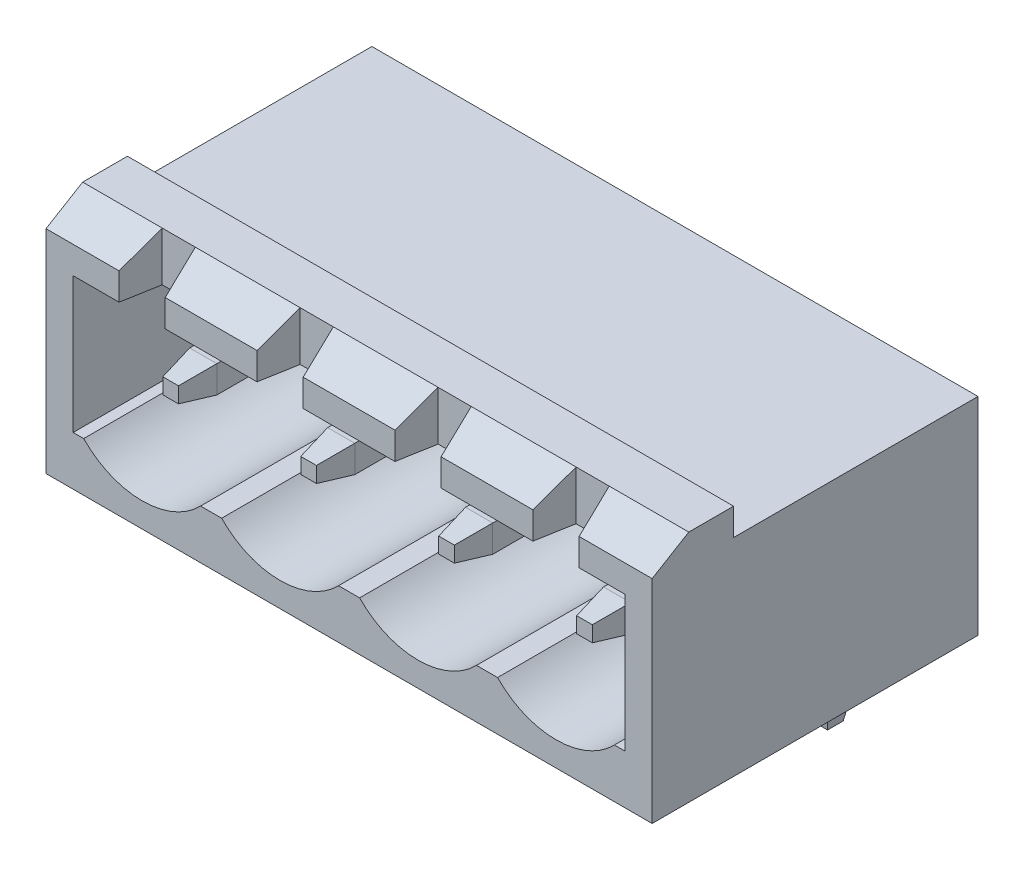
from build123d import *

# Parameters (mm, degrees)
SKETCH1_W           = 22.32
SKETCH1_H           = 7.62
BOSS_EXTRUDE1_DEPTH = 6
BOSS_EXTRUDE6_DEPTH = 22.32
CUT_EXTRUDE1_DEPTH  = 11.2
BOSS_EXTRUDE2_START = 2.5
BOSS_EXTRUDE2_DEPTH = 2.5
SKETCH4_R           = 1
BOSS_EXTRUDE3_DEPTH = 0.7
SKETCH5_W           = 1
SKETCH5_H           = 1
BOSS_EXTRUDE4_DEPTH = 5.75
SKETCH6_W           = 1
SKETCH6_H           = 1
BOSS_EXTRUDE5_DEPTH = 1.2
BOSS_EXTRUDE5_TAPER = 10
CUT_EXTRUDE2_START  = -1.81
CUT_EXTRUDE2_DEPTH  = 1.81
SKETCH10_W          = 1
SKETCH10_H          = 1
BOSS_EXTRUDE7_DEPTH = 2.3
SKETCH11_W          = 1
SKETCH11_H          = 1
BOSS_EXTRUDE8_DEPTH = 1.2
BOSS_EXTRUDE8_TAPER = 10
SKETCH12_W          = 2
SKETCH12_H          = 6.75
CUT_EXTRUDE3_DEPTH  = 0.5
LPATTERN1_COUNT     = 4
LPATTERN1_PITCH     = 5.08
LPATTERN2_COUNT     = 4
LPATTERN2_PITCH     = 5.08


with BuildPart() as part:
    # Sketch1 → Boss-Extrude1 (new, symmetric)
    with BuildSketch(Plane.XY):
        Rectangle(SKETCH1_W, SKETCH1_H)
    extrude(amount=BOSS_EXTRUDE1_DEPTH, both=True)

    # Sketch7 → Boss-Extrude6 (add)
    with BuildSketch(Plane(origin=(11.16, 0, 0), x_dir=(0, 0, -1), z_dir=(1, 0, 0))):
        Polygon((-6, 3.81), (-6, 4), (-4.65, 4.81), (-3, 4.81), (-3, 3.81), align=None)
    extrude(amount=-BOSS_EXTRUDE6_DEPTH)

    # Sketch2 → Cut-Extrude1 (cut)
    with BuildSketch(Plane.XY.offset(6)):
        with BuildLine():
            Line((5.467815064, -2), (5.08, -2))
            Line((5.08, -2), (5.08, 3))
            Line((5.08, 3), (10.16, 3))
            Line((10.16, 3), (10.16, -2))
            Line((10.16, -2), (9.772184936, -2))
            ThreePointArc((9.772184936, -2), (7.62, -2.91), (5.467815064, -2))
        make_face()
    cut_extrude1 = extrude(amount=-CUT_EXTRUDE1_DEPTH, mode=Mode.SUBTRACT)

    # Sketch3 → Boss-Extrude2 (add)
    with BuildSketch(Plane.XY.offset(-5.2).offset(BOSS_EXTRUDE2_START)):
        with BuildLine():
            Line((6.62, -1.028033989), (6.62, -2.738427125))
            ThreePointArc((6.62, -2.738427125), (7.62, -2.91), (8.62, -2.738427125))
            Line((8.62, -2.738427125), (8.62, -1.028033989))
            ThreePointArc((8.62, -1.028033989), (8.933299556, -0.634737384), (9.099019946, -0.16))
            Line((9.099019946, -0.16), (10.16, -0.16))
            Line((10.16, -0.16), (10.16, 0.34))
            Line((10.16, 0.34), (9.099019946, 0.34))
            ThreePointArc((9.099019946, 0.34), (8.680660172, 1.150660172), (7.87, 1.569019946))
            Line((7.87, 1.569019946), (7.87, 3))
            Line((7.87, 3), (7.37, 3))
            Line((7.37, 3), (7.37, 1.569019946))
            ThreePointArc((7.37, 1.569019946), (6.559339828, 1.150660172), (6.140980054, 0.34))
            Line((6.140980054, 0.34), (5.08, 0.34))
            Line((5.08, 0.34), (5.08, -0.16))
            Line((5.08, -0.16), (6.140980054, -0.16))
            ThreePointArc((6.140980054, -0.16), (6.306700444, -0.634737384), (6.62, -1.028033989))
        make_face()
    boss_extrude2 = extrude(amount=-BOSS_EXTRUDE2_DEPTH)

    # Sketch4 → Boss-Extrude3 (add)
    with BuildSketch(Plane.XY.offset(-2.7)):
        with Locations((7.62, 0.09)):
            Circle(SKETCH4_R)
    boss_extrude3 = extrude(amount=BOSS_EXTRUDE3_DEPTH)

    # Sketch9 → Cut-Extrude2 (cut)
    with BuildSketch(Plane(origin=(0, 4.81, 0), x_dir=(1, 0, 0), z_dir=(0, 1, 0)).offset(CUT_EXTRUDE2_START)):
        Polygon((6.77, -6), (7.01, -4.65), (8.23, -4.65), (8.47, -6), align=None)
    cut_extrude2 = extrude(amount=CUT_EXTRUDE2_DEPTH, mode=Mode.SUBTRACT)

    # Sketch12 → Cut-Extrude3 (cut)
    with BuildSketch(Plane(origin=(0, 0, -6), x_dir=(-1, 0, 0), z_dir=(0, 0, -1))):
        with Locations((-7.62, -0.435)):
            Rectangle(SKETCH12_W, SKETCH12_H)
    cut_extrude3 = extrude(amount=-CUT_EXTRUDE3_DEPTH, mode=Mode.SUBTRACT)

    # LPattern1: Cut-Extrude1, Boss-Extrude2, Boss-Extrude3, Cut-Extrude2, Cut-Extrude3 ×4
    with Locations(*[(-i * LPATTERN1_PITCH, 0, 0) for i in range(1, LPATTERN1_COUNT)]):
        add(cut_extrude1, mode=Mode.SUBTRACT)
        add(boss_extrude2)
        add(boss_extrude3)
        add(cut_extrude2, mode=Mode.SUBTRACT)
        add(cut_extrude3, mode=Mode.SUBTRACT)


with BuildPart() as body_2:
    # Sketch5 → Boss-Extrude4 (new body)
    with BuildSketch(Plane.XY.offset(-2)):
        with Locations((7.62, 0.09)):
            Rectangle(SKETCH5_W, SKETCH5_H)
    extrude(amount=BOSS_EXTRUDE4_DEPTH)

    # Sketch6 → Boss-Extrude5 (add)
    with BuildSketch(Plane.XY.offset(3.75)):
        with Locations((7.62, 0.09)):
            Rectangle(SKETCH6_W, SKETCH6_H)
    extrude(amount=BOSS_EXTRUDE5_DEPTH, taper=BOSS_EXTRUDE5_TAPER)


with BuildPart() as body_3:
    # Sketch10 → Boss-Extrude7 (new body)
    with BuildSketch(Plane.XZ.offset(3.81)):
        with Locations((7.62, -4)):
            Rectangle(SKETCH10_W, SKETCH10_H)
    extrude(amount=BOSS_EXTRUDE7_DEPTH)

    # Sketch11 → Boss-Extrude8 (add)
    with BuildSketch(Plane.XZ.offset(6.11)):
        with Locations((7.62, -4)):
            Rectangle(SKETCH11_W, SKETCH11_H)
    extrude(amount=BOSS_EXTRUDE8_DEPTH, taper=BOSS_EXTRUDE8_TAPER)


with BuildPart() as lpattern2_1:
    # LPattern2: pattern copy
    add(body_3.part.moved(Location(Vector(-1, 0, 0) * (1 * LPATTERN2_PITCH))))


with BuildPart() as lpattern2_2:
    # LPattern2: pattern copy
    add(body_3.part.moved(Location(Vector(-1, 0, 0) * (2 * LPATTERN2_PITCH))))


with BuildPart() as lpattern2_3:
    # LPattern2: pattern copy
    add(body_3.part.moved(Location(Vector(-1, 0, 0) * (3 * LPATTERN2_PITCH))))


with BuildPart() as lpattern2_4:
    # LPattern2: pattern copy
    add(body_2.part.moved(Location(Vector(-1, 0, 0) * (1 * LPATTERN2_PITCH))))


with BuildPart() as lpattern2_5:
    # LPattern2: pattern copy
    add(body_2.part.moved(Location(Vector(-1, 0, 0) * (2 * LPATTERN2_PITCH))))


with BuildPart() as lpattern2_6:
    # LPattern2: pattern copy
    add(body_2.part.moved(Location(Vector(-1, 0, 0) * (3 * LPATTERN2_PITCH))))


solid = Compound([part.part, body_2.part, body_3.part, lpattern2_1.part, lpattern2_2.part, lpattern2_3.part, lpattern2_4.part, lpattern2_5.part, lpattern2_6.part])
